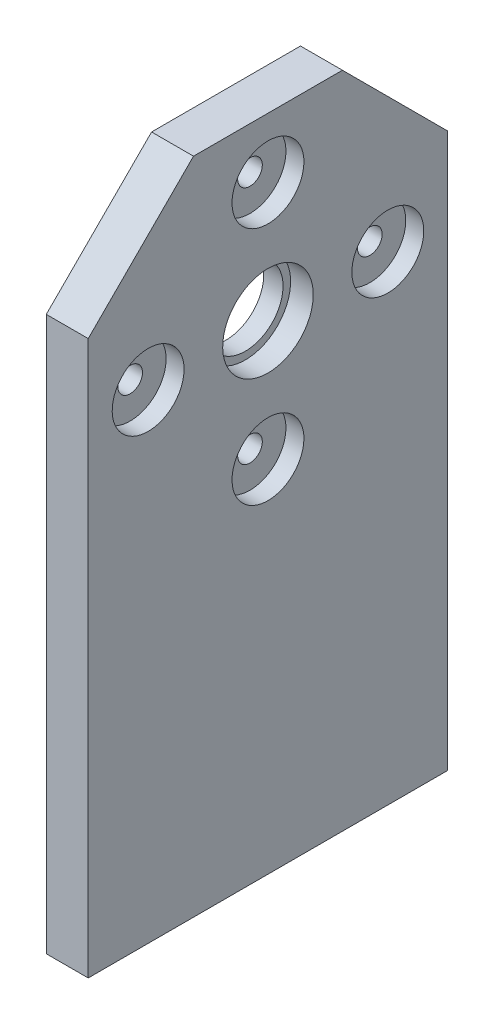
from build123d import *

# Parameters (mm, degrees)
BOSS_EXTRUDE1_DEPTH = 11.1125
SKETCH2_R           = 12
CUT_EXTRUDE1_DEPTH  = 6
SKETCH3_R           = 10
CUT_EXTRUDE2_DEPTH  = 136.768702671
SKETCH4_R           = 3.2639
CUT_EXTRUDE3_DEPTH  = 137.09051503
SKETCH5_R           = 9.525
CUT_EXTRUDE4_DEPTH  = 4.7625
SKETCH6_R           = 2.778125
CUT_EXTRUDE5_DEPTH  = 38.1


with BuildPart() as part:
    # Sketch1 → Boss-Extrude1 (new body)
    with BuildSketch(Plane(origin=(-18.0375, 0, 0), x_dir=(0, 0, -1), z_dir=(1, 0, 0))):
        Polygon((-47.625, -127), (-47.625, 19.726920908), (-19.726920908, 47.625), (19.726920908, 47.625), (47.625, 19.726920908), (47.625, -127), align=None)
    extrude(amount=-BOSS_EXTRUDE1_DEPTH)

    # Sketch2 → Cut-Extrude1 (cut)
    with BuildSketch(Plane(origin=(-18.0375, 0, 0), x_dir=(0, 0, -1), z_dir=(1, 0, 0))):
        with Locations(Location((0, 0, 0), (0, 0, 90))):
            Circle(SKETCH2_R)
    extrude(amount=-CUT_EXTRUDE1_DEPTH, mode=Mode.SUBTRACT)

    # Sketch3 → Cut-Extrude2 (cut, through all)
    with BuildSketch(Plane(origin=(-24.0375, 0, 0), x_dir=(0, 0, -1), z_dir=(1, 0, 0))):
        with Locations(Location((0, 0, 0), (0, 0, 90))):
            Circle(SKETCH3_R)
    extrude(amount=-CUT_EXTRUDE2_DEPTH, mode=Mode.SUBTRACT)

    # Sketch4 → Cut-Extrude3 (cut, through all)
    with BuildSketch(Plane.ZY.offset(29.15)):
        with Locations((0, -31.75)):
            Circle(SKETCH4_R)
        with Locations((31.75, 0)):
            Circle(SKETCH4_R)
        with Locations((-31.75, 0)):
            Circle(SKETCH4_R)
        with Locations((0, 31.75)):
            Circle(SKETCH4_R)
    extrude(amount=-CUT_EXTRUDE3_DEPTH, mode=Mode.SUBTRACT)

    # Sketch5 → Cut-Extrude4 (cut)
    with BuildSketch(Plane(origin=(-18.0375, 0, 0), x_dir=(0, 0, -1), z_dir=(1, 0, 0))):
        with Locations(Location((-31.75, 0, 0), (0, 0, 90))):
            Circle(SKETCH5_R)
        with Locations(Location((0, 31.75, 0), (0, 0, 90))):
            Circle(SKETCH5_R)
        with Locations(Location((31.75, 0, 0), (0, 0, 90))):
            Circle(SKETCH5_R)
        with Locations(Location((0, -31.75, 0), (0, 0, 90))):
            Circle(SKETCH5_R)
    extrude(amount=-CUT_EXTRUDE4_DEPTH, mode=Mode.SUBTRACT)

    # Sketch6 → Cut-Extrude5 (cut)
    with BuildSketch(Plane.XZ.offset(127)):
        with Locations((-23.59375, 0)):
            Circle(SKETCH6_R)
        with Locations((-23.59375, 38.1)):
            Circle(SKETCH6_R)
        with Locations((-23.59375, -38.1)):
            Circle(SKETCH6_R)
    extrude(amount=-CUT_EXTRUDE5_DEPTH, mode=Mode.SUBTRACT)


solid = part.part
